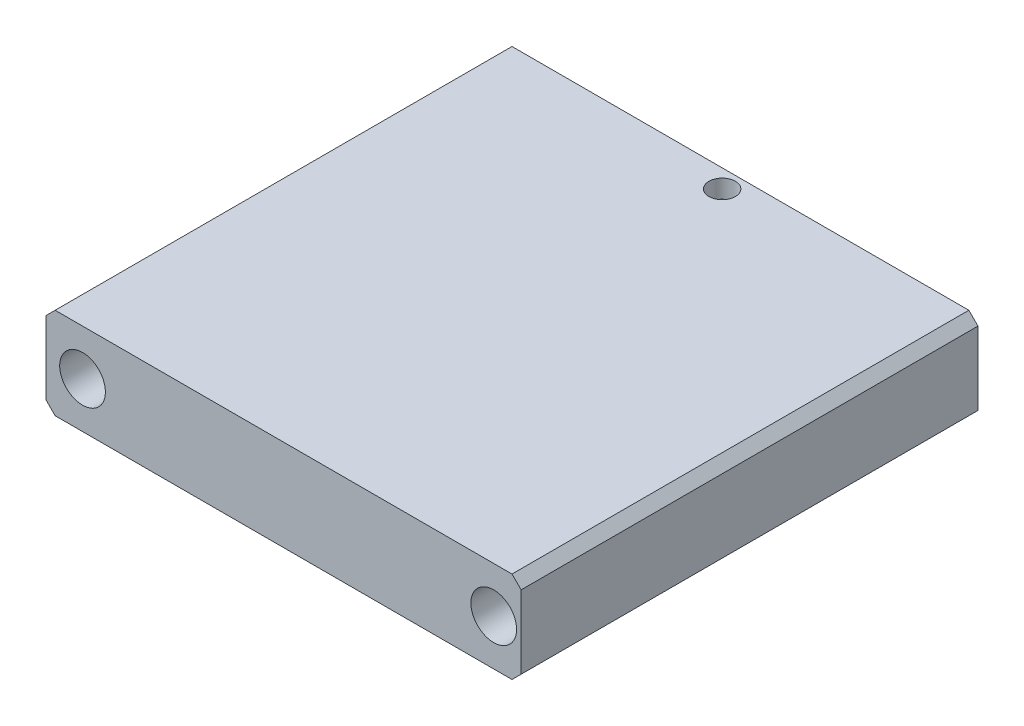
from build123d import *

# Parameters (mm, degrees)
BOSS_EXTRUDE1_DEPTH = 50
SKETCH2_R           = 2.5
CUT_EXTRUDE1_DEPTH  = 68.194635476
SKETCH3_R           = 1.45
CUT_EXTRUDE2_DEPTH  = 68.26652433
SKETCH4_W           = 6
SKETCH4_H           = 6
CUT_EXTRUDE4_DEPTH  = 6


with BuildPart() as part:
    # Sketch1 → Boss-Extrude1 (new body)
    with BuildSketch(Plane.XY):
        Polygon((42.872375084, -9.504406412), (43.872375084, -8.504406412), (43.872375084, -0.504406412), (42.872375084, 0.495593588), (-7.127624916, 0.495593588), (-8.127624916, -0.504406412), (-8.127624916, -8.504406412), (-7.127624916, -9.504406412), align=None)
    extrude(amount=BOSS_EXTRUDE1_DEPTH)

    # Sketch2 → Cut-Extrude1 (cut, through all)
    with BuildSketch(Plane.XY.offset(50)):
        with Locations((-4.127624916, -4.504406412)):
            Circle(SKETCH2_R)
        with Locations((40.872375084, -4.504406412)):
            Circle(SKETCH2_R)
    extrude(amount=-CUT_EXTRUDE1_DEPTH, mode=Mode.SUBTRACT)

    # Sketch3 → Cut-Extrude2 (cut, through all)
    with BuildSketch(Plane.XZ.offset(9.504406412)):
        with Locations(Location((17.872375084, 2, 0), (0, 0, 270))):
            Circle(SKETCH3_R)
    extrude(amount=-CUT_EXTRUDE2_DEPTH, mode=Mode.SUBTRACT)

    # Sketch4 → Cut-Extrude4 (cut)
    with BuildSketch(Plane(origin=(0, 0, 0), x_dir=(-1, 0, 0), z_dir=(0, 0, -1))):
        with Locations((-17.872375084, -4.504406412)):
            Rectangle(SKETCH4_W, SKETCH4_H)
    extrude(amount=-CUT_EXTRUDE4_DEPTH, mode=Mode.SUBTRACT)


solid = part.part
